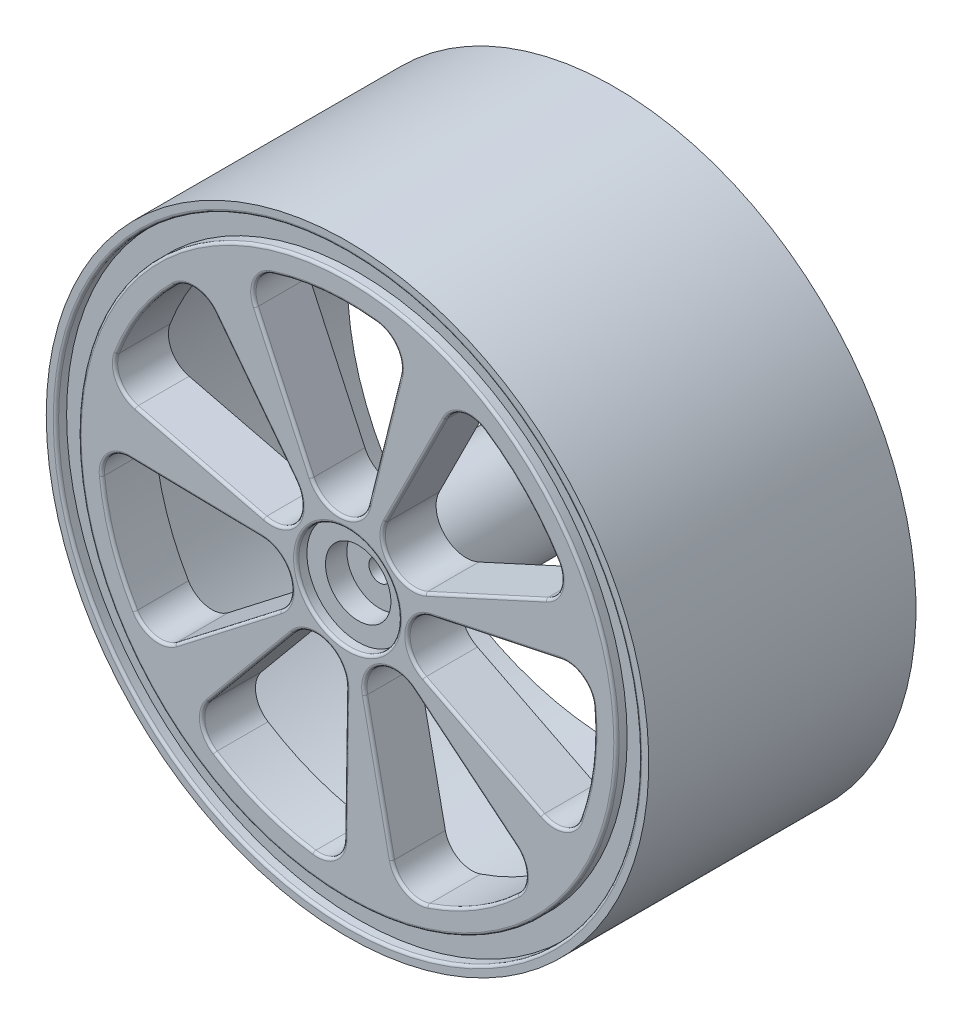
from build123d import *

# Parameters (mm, degrees)
MODEL_R             = 5
EXTRUDE_1_DEPTH     = 20
SKETCH_2_R          = 33
EXTRUDE_2_DEPTH     = 5
EXTRUDE_START       = 20
SKETCH_3_R          = 33
SKETCH_3_R_2        = 25
EXTRUDE_3_DEPTH     = 20
SKETCH_4_R          = 33
SKETCH_4_R_2        = 28.19022281
CUT_EXTRUDE_1_DEPTH = 25
SKETCH_5_R          = 3.061619724
CUT_EXTRUDE_3_DEPTH = 3
SKETCH_6_R          = 4.800333219
CUT_EXTRUDE_4_DEPTH = 1
SKETCH_7_R          = 1
CUT_EXTRUDE_5_DEPTH = 40
CUT_EXTRUDE_6_DEPTH = 40
FILLET_1_R          = 0.25
FILLET_3_R          = 0.25
FILLET_4_R          = 0.25
FILLET_5_R          = 0.25
FILLET_6_R          = 0.25
FILLET_7_R          = 0.25
FILLET_8_R          = 0.25
FILLET_9_R          = 0.25
SKETCH_9_R          = 27.284655203
SKETCH_9_R_2        = 25.169377032
CUT_EXTRUDE_7_DEPTH = 1
FILLET_10_R         = 0.25
FILLET_11_R         = 0.25


with BuildPart() as part:
    # Model → 凸台-拉伸1 (new body)
    with BuildSketch(Plane.XY):
        with Locations((797.832325437, 276.566635927)):
            Circle(MODEL_R)
        with BuildLine():
            Line((796.170809224, 277.679903133), (798.853062492, 278.286547512))
            ThreePointArc((798.853062492, 278.286547512), (798.273521349, 274.615906277), (796.170809224, 277.679903133))
        make_face(mode=Mode.SUBTRACT)
    extrude(amount=EXTRUDE_1_DEPTH)

    # 草图2 → 凸台-拉伸2 (add)
    with BuildSketch(Plane.XY.offset(20)):
        with Locations((797.832325437, 276.566635927)):
            Circle(SKETCH_2_R)
    extrude(amount=EXTRUDE_2_DEPTH)

    # 草图3 → 凸台-拉伸3 (add)
    with BuildSketch(Plane(origin=(0, 0, 20), x_dir=(-1, 0, 0), z_dir=(0, 0, -1)).offset(EXTRUDE_START)):
        with Locations((-797.832325437, 276.566635927)):
            Circle(SKETCH_3_R)
        with Locations((-797.832325437, 276.566635927)):
            Circle(SKETCH_3_R_2, mode=Mode.SUBTRACT)
    extrude(amount=-EXTRUDE_3_DEPTH)

    # 草图4 → 切除-拉伸1 (cut)
    with BuildSketch(Plane(origin=(0, 0, 0), x_dir=(-1, 0, 0), z_dir=(0, 0, -1))):
        with Locations((-797.832325437, 276.566635927)):
            Circle(SKETCH_4_R)
        with Locations((-797.832325437, 276.566635927)):
            Circle(SKETCH_4_R_2, mode=Mode.SUBTRACT)
    extrude(amount=-CUT_EXTRUDE_1_DEPTH, mode=Mode.SUBTRACT)

    # 草图5 → 切除-拉伸3 (cut)
    with BuildSketch(Plane.XY.offset(25)):
        with Locations((797.832325437, 276.566635927)):
            Circle(SKETCH_5_R)
    extrude(amount=-CUT_EXTRUDE_3_DEPTH, mode=Mode.SUBTRACT)

    # 草图6 → 切除-拉伸4 (cut)
    with BuildSketch(Plane.XY.offset(25)):
        with Locations((797.832325437, 276.566635927)):
            Circle(SKETCH_6_R)
    extrude(amount=-CUT_EXTRUDE_4_DEPTH, mode=Mode.SUBTRACT)

    # 草图7 → 切除-拉伸5 (cut)
    with BuildSketch(Plane.XY.offset(22)):
        with Locations((797.832325437, 276.566635927)):
            Circle(SKETCH_7_R)
    extrude(amount=-CUT_EXTRUDE_5_DEPTH, mode=Mode.SUBTRACT)

    # 草图8 → 切除-拉伸6 (cut)
    with BuildSketch(Plane.XY.offset(25)):
        with BuildLine():
            Line((790.042110116, 278.468110041), (778.012217233, 281.404425532))
            ThreePointArc((778.012217233, 281.404425532), (776.366329321, 282.689917741), (776.240266413, 284.774514915))
            ThreePointArc((776.240266413, 284.774514915), (778.487037526, 289.189873469), (781.623633956, 293.024600895))
            ThreePointArc((781.623633956, 293.024600895), (783.582470105, 293.748754318), (785.421959492, 292.759959074))
            Line((785.421959492, 292.759959074), (792.954480073, 282.931357692))
            ThreePointArc((792.954480073, 282.931357692), (793.078123539, 279.668860104), (790.042110116, 278.468110041))
        make_face()
        with BuildLine():
            Line((799.76717845, 284.348628111), (802.755038675, 296.365822572))
            ThreePointArc((802.755038675, 296.365822572), (802.381207054, 298.420497037), (800.593726747, 299.500474532))
            ThreePointArc((800.593726747, 299.500474532), (795.639980232, 299.561850927), (790.787075032, 298.565516287))
            ThreePointArc((790.787075032, 298.565516287), (789.23587027, 297.167231257), (789.257026319, 295.078932988))
            Line((789.257026319, 295.078932988), (794.461837956, 283.842821238))
            ThreePointArc((794.461837956, 283.842821238), (797.293545565, 282.217825782), (799.76717845, 284.348628111))
        make_face()
        with BuildLine():
            Line((805.122893045, 279.905899692), (816.381214385, 285.062494696))
            ThreePointArc((816.381214385, 285.062494696), (817.754543364, 286.635836602), (817.484428028, 288.706699935))
            ThreePointArc((817.484428028, 288.706699935), (814.443803593, 292.617962472), (810.639100903, 295.790912052))
            ThreePointArc((810.639100903, 295.790912052), (808.578717295, 296.131876314), (806.959210545, 294.813303175))
            Line((806.959210545, 294.813303175), (801.419611614, 283.738416488))
            ThreePointArc((801.419611614, 283.738416488), (801.914679824, 280.511330235), (805.122893045, 279.905899692))
        make_face()
        with BuildLine():
            Line((804.98866153, 272.948637549), (816.039698389, 267.361611883))
            ThreePointArc((816.039698389, 267.361611883), (818.126043237, 267.268862684), (819.576695229, 268.771209527))
            ThreePointArc((819.576695229, 268.771209527), (820.738845089, 273.587097742), (820.847363637, 278.540035791))
            ThreePointArc((820.847363637, 278.540035791), (819.829312064, 280.363496301), (817.788664129, 280.80756076))
            Line((817.788664129, 280.80756076), (805.676085613, 278.233514698))
            ThreePointArc((805.676085613, 278.233514698), (803.461717964, 275.834399417), (804.98866153, 272.948637549))
        make_face()
        with BuildLine():
            Line((799.465562974, 268.715801978), (801.987659197, 256.592299923))
            ThreePointArc((801.987659197, 256.592299923), (803.215959689, 254.903301658), (805.295008471, 254.705834196))
            ThreePointArc((805.295008471, 254.705834196), (809.78481008, 256.799886036), (813.724833185, 259.803149181))
            ThreePointArc((813.724833185, 259.803149181), (814.515727246, 261.736002984), (813.590587643, 263.608315446))
            Line((813.590587643, 263.608315446), (804.026048216, 271.473419194))
            ThreePointArc((804.026048216, 271.473419194), (800.769708713, 271.708857625), (799.465562974, 268.715801978))
        make_face()
        with BuildLine():
            Line((792.712603241, 270.394804498), (784.80656893, 260.864070376))
            ThreePointArc((784.80656893, 260.864070376), (784.251889743, 258.850673187), (785.393769178, 257.102088447))
            ThreePointArc((785.393769178, 257.102088447), (789.830310348, 254.897440166), (794.634920251, 253.689510004))
            ThreePointArc((794.634920251, 253.689510004), (796.639200586, 254.276278763), (797.526218306, 256.166949755))
            Line((797.526218306, 256.166949755), (797.712011237, 268.548619773))
            ThreePointArc((797.712011237, 268.548619773), (795.865789943, 271.241321975), (792.712603241, 270.394804498))
        make_face()
        with BuildLine():
            Line((789.814898744, 276.721321967), (777.43413899, 276.960192962))
            ThreePointArc((777.43413899, 276.960192962), (775.514164865, 276.138525999), (774.859016448, 274.155543954))
            ThreePointArc((774.859016448, 274.155543954), (775.901491189, 269.312340675), (777.952718636, 264.802813255))
            ThreePointArc((777.952718636, 264.802813255), (779.661121274, 263.601648126), (781.692353881, 264.08696383))
            Line((781.692353881, 264.08696383), (791.488573304, 271.661550053))
            ThreePointArc((791.488573304, 271.661550053), (792.44271251, 274.783856347), (789.814898744, 276.721321967))
        make_face()
    extrude(amount=-CUT_EXTRUDE_6_DEPTH, mode=Mode.SUBTRACT)

    # 圆角1
    fillet_1_edges = [part.edges().sort_by_distance(p)[0] for p in [
        (793.031992218, 276.566635927, 25),
    ]]
    fillet(fillet_1_edges, radius=FILLET_1_R)

    # 圆角3
    fillet_3_edges = [part.edges().sort_by_distance(p)[0] for p in [
        (817.754543364, 286.635836602, 25),
        (814.443803593, 292.617962472, 25),
        (808.578717295, 296.131876314, 25),
        (804.18941108, 289.275859832, 25),
        (801.914679824, 280.511330235, 25),
        (810.752053715, 282.484197194, 25),
    ]]
    fillet(fillet_3_edges, radius=FILLET_3_R)

    # 圆角4
    fillet_4_edges = [part.edges().sort_by_distance(p)[0] for p in [
        (802.381207054, 298.420497037, 25),
        (795.639980232, 299.561850927, 25),
        (789.23587027, 297.167231257, 25),
        (791.859432138, 289.460877113, 25),
        (797.293545565, 282.217825782, 25),
        (801.261108563, 290.357225342, 25),
    ]]
    fillet(fillet_4_edges, radius=FILLET_4_R)

    # 圆角5
    fillet_5_edges = [part.edges().sort_by_distance(p)[0] for p in [
        (783.582470105, 293.748754318, 25),
        (778.487037526, 289.189873469, 25),
        (776.366329321, 282.689917741, 25),
        (784.027163675, 279.936267787, 25),
        (793.078123539, 279.668860104, 25),
        (789.188219782, 287.845658383, 25),
    ]]
    fillet(fillet_5_edges, radius=FILLET_5_R)

    # 圆角6
    fillet_6_edges = [part.edges().sort_by_distance(p)[0] for p in [
        (775.514164865, 276.138525999, 25),
        (775.901491189, 269.312340675, 25),
        (779.661121274, 263.601648126, 25),
        (786.590463593, 267.874256941, 25),
        (792.44271251, 274.783856347, 25),
        (783.624518867, 276.840757464, 25),
    ]]
    fillet(fillet_6_edges, radius=FILLET_6_R)

    # 圆角7
    fillet_7_edges = [part.edges().sort_by_distance(p)[0] for p in [
        (784.251889743, 258.850673187, 25),
        (789.830310348, 254.897440166, 25),
        (796.639200586, 254.276278763, 25),
        (797.619114771, 262.357784764, 25),
        (795.865789943, 271.241321975, 25),
        (788.759586085, 265.629437437, 25),
    ]]
    fillet(fillet_7_edges, radius=FILLET_7_R)

    # 圆角8
    fillet_8_edges = [part.edges().sort_by_distance(p)[0] for p in [
        (803.215959689, 254.903301658, 25),
        (809.78481008, 256.799886036, 25),
        (814.515727246, 261.736002984, 25),
        (808.80831793, 267.54086732, 25),
        (800.769708713, 271.708857625, 25),
        (800.726611085, 262.65405095, 25),
    ]]
    fillet(fillet_8_edges, radius=FILLET_8_R)

    # 圆角9
    fillet_9_edges = [part.edges().sort_by_distance(p)[0] for p in [
        (818.126043237, 267.268862684, 25),
        (820.738845089, 273.587097742, 25),
        (819.829312064, 280.363496301, 25),
        (811.732374871, 279.520537729, 25),
        (803.461717964, 275.834399417, 25),
        (810.514179959, 270.155124716, 25),
    ]]
    fillet(fillet_9_edges, radius=FILLET_9_R)

    # 草图9 → 切除-拉伸7 (cut)
    with BuildSketch(Plane.XY.offset(25)):
        with Locations((797.832325437, 276.566635927)):
            Circle(SKETCH_9_R)
        with Locations((797.832325437, 276.566635927)):
            Circle(SKETCH_9_R_2, mode=Mode.SUBTRACT)
    extrude(amount=-CUT_EXTRUDE_7_DEPTH, mode=Mode.SUBTRACT)

    # 圆角10
    fillet_10_edges = [part.edges().sort_by_distance(p)[0] for p in [
        (770.547670234, 276.566635927, 25),
    ]]
    fillet(fillet_10_edges, radius=FILLET_10_R)

    # 圆角11
    fillet_11_edges = [part.edges().sort_by_distance(p)[0] for p in [
        (772.662948405, 276.566635927, 25),
    ]]
    fillet(fillet_11_edges, radius=FILLET_11_R)


solid = part.part
